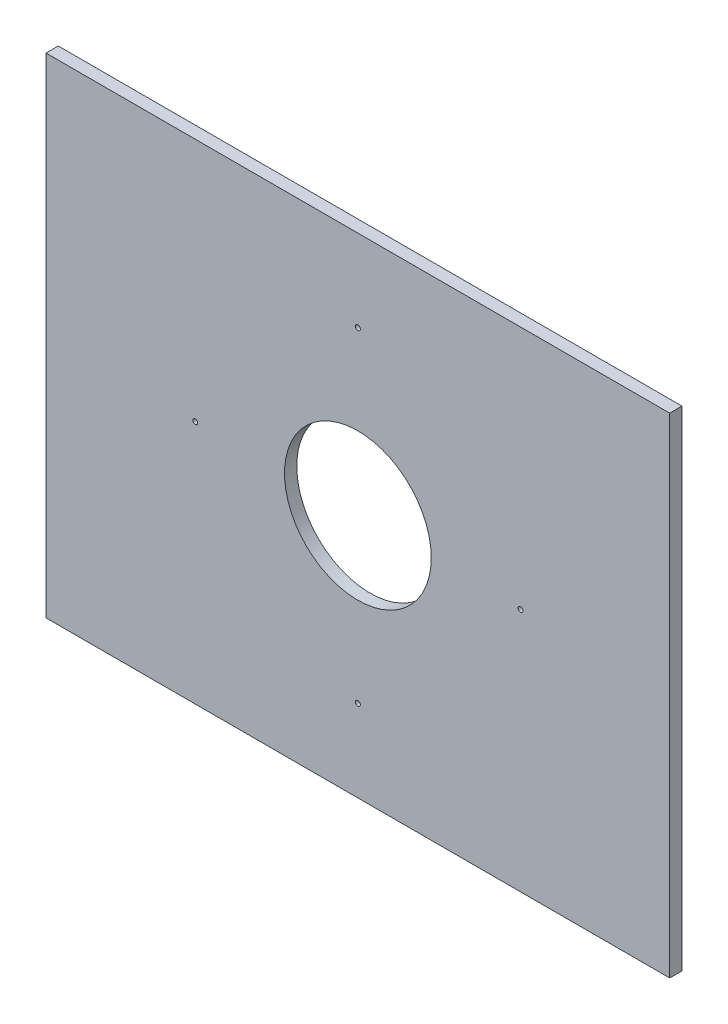
from build123d import *

# Parameters (mm, degrees)
SKETCH1_W           = 255
SKETCH1_H           = 200
SKETCH1_R           = 30
BOSS_EXTRUDE1_DEPTH = 5
SKETCH2_R           = 1
CUT_EXTRUDE1_DEPTH  = 28


with BuildPart() as part:
    # Sketch1 → Boss-Extrude1 (new body)
    with BuildSketch(Plane.XY):
        with Locations((127.5, 100)):
            Rectangle(SKETCH1_W, SKETCH1_H)
        with Locations((127.5, 100)):
            Circle(SKETCH1_R, mode=Mode.SUBTRACT)
    extrude(amount=BOSS_EXTRUDE1_DEPTH)

    # Sketch2 → Cut-Extrude1 (cut)
    with BuildSketch(Plane.XY):
        with Locations(Location((61, 100, 0), (0, 0, 180))):
            Circle(SKETCH2_R)
        with Locations(Location((127.5, 166.5, 0), (0, 0, 180))):
            Circle(SKETCH2_R)
        with Locations(Location((194, 100, 0), (0, 0, 180))):
            Circle(SKETCH2_R)
        with Locations(Location((127.5, 33.5, 0), (0, 0, 180))):
            Circle(SKETCH2_R)
    extrude(amount=CUT_EXTRUDE1_DEPTH, mode=Mode.SUBTRACT)


solid = part.part
